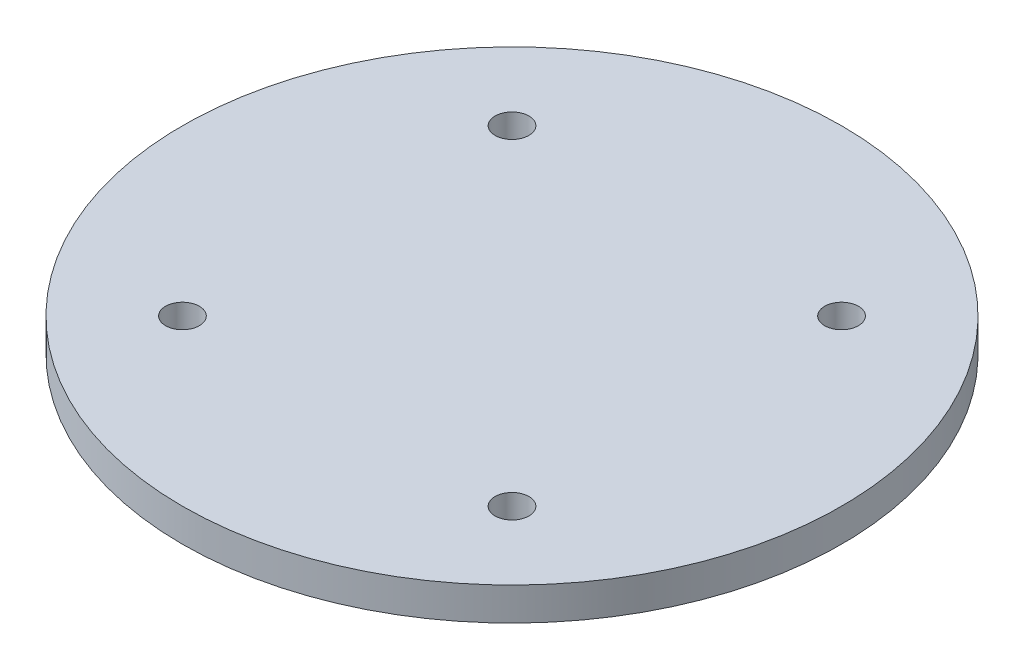
from build123d import *

# Parameters (mm, degrees)
SKETCH_1_R          = 20
EXTRUDE_1_DEPTH     = 2
HOLE_WIZARD_M2_51_D = 2.05


with BuildPart() as part:
    # Эскиз1 → Бобышка-Вытянуть1 (new body)
    with BuildSketch(Plane(origin=(0, 0, 0), x_dir=(1, 0, 0), z_dir=(0, 1, 0))):
        with Locations(Location((0, 0, 0), (0, 0, 270))):
            Circle(SKETCH_1_R)
    extrude(amount=EXTRUDE_1_DEPTH)

    # Отверстие обработанное метчиком M2.51 (through all)
    with Locations(Plane(origin=(0, 2, 0), x_dir=(1, 0, 0), z_dir=(0, 1, 0))):
        with Locations((-10, 10), (10, 10), (-10, -10), (10, -10)):
            Hole(HOLE_WIZARD_M2_51_D / 2)


solid = part.part
